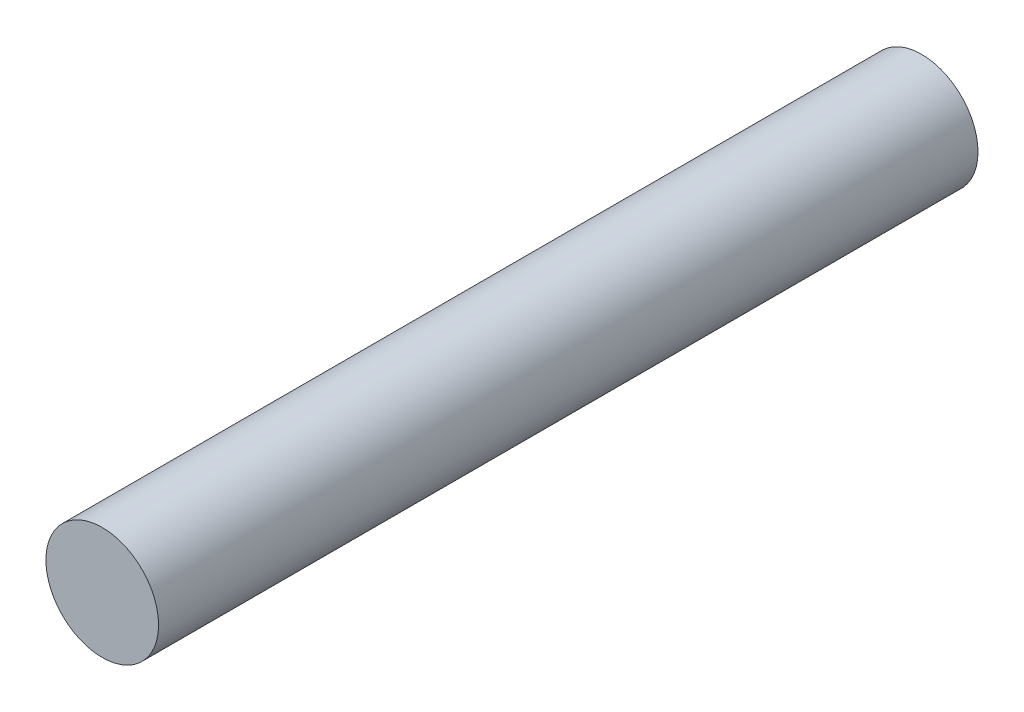
from build123d import *

# Parameters (mm, degrees)
IZIM1_R                     = 2.75
Y_KSEKLIK_EKSTR_ZYON1_DEPTH = 40


with BuildPart() as part:
    # Çizim1 → Yükseklik-Ekstrüzyon1 (new body)
    with BuildSketch(Plane.XY):
        Circle(IZIM1_R)
    extrude(amount=Y_KSEKLIK_EKSTR_ZYON1_DEPTH)


solid = part.part
